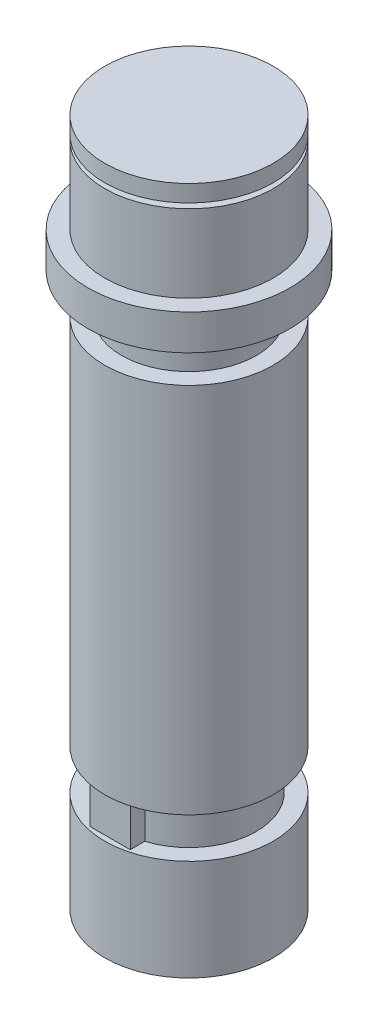
from build123d import *

# Parameters (mm, degrees)
SKETCH1_R            = 20
BOSS_EXTRUDE4_DEPTH  = 11.938
SKETCH2_R            = 25
BOSS_EXTRUDE8_DEPTH  = 30
BOSS_EXTRUDE9_START  = 110.4
SKETCH7_R            = 25
BOSS_EXTRUDE9_DEPTH  = 110.4
SKETCH8_R            = 20
BOSS_EXTRUDE11_DEPTH = 11.9
BOSS_EXTRUDE12_START = -12.9
BOSS_EXTRUDE12_DEPTH = 12.9
SKETCH12_R           = 30
BOSS_EXTRUDE14_DEPTH = 10.5
BOSS_EXTRUDE15_START = 23
SKETCH14_R           = 25
BOSS_EXTRUDE15_DEPTH = 23
SKETCH15_R           = 5
BOSS_EXTRUDE17_DEPTH = 1.5
BOSS_EXTRUDE21_START = 5
SKETCH17_R           = 25
BOSS_EXTRUDE21_DEPTH = 5


with BuildPart() as part:
    # Sketch1 → Boss-Extrude4 (new body)
    with BuildSketch(Plane(origin=(0, 0, 0), x_dir=(1, 0, 0), z_dir=(0, 1, 0))):
        Circle(SKETCH1_R)
        with BuildLine():
            Line((-5.969, -19.088505416), (-5.969, -23.406505416))
            Line((-5.969, -23.406505416), (5.969, -23.406505416))
            Line((5.969, -23.406505416), (5.969, -19.088505416))
            ThreePointArc((5.969, -19.088505416), (0, -20), (-5.969, -19.088505416))
        make_face()
    extrude(amount=BOSS_EXTRUDE4_DEPTH)

    # Sketch2 → Boss-Extrude8 (add)
    with BuildSketch(Plane(origin=(0, 0, 0), x_dir=(1, 0, 0), z_dir=(0, 1, 0))):
        with Locations(Location((0, 0, 0), (0, 0, 270))):
            Circle(SKETCH2_R)
    extrude(amount=-BOSS_EXTRUDE8_DEPTH)

    # Sketch7 → Boss-Extrude9 (add)
    with BuildSketch(Plane(origin=(0, 11.938, 0), x_dir=(1, 0, 0), z_dir=(0, 1, 0)).offset(BOSS_EXTRUDE9_START)):
        with Locations(Location((0, 0, 0), (0, 0, 270))):
            Circle(SKETCH7_R)
    extrude(amount=-BOSS_EXTRUDE9_DEPTH)

    # Sketch8 → Boss-Extrude11 (add)
    with BuildSketch(Plane(origin=(0, 122.338, 0), x_dir=(1, 0, 0), z_dir=(0, 1, 0))):
        with Locations(Location((0, 0, 0), (0, 0, 90))):
            Circle(SKETCH8_R)
    extrude(amount=BOSS_EXTRUDE11_DEPTH)

    # Sketch9 → Boss-Extrude12 (add)
    with BuildSketch(Plane(origin=(0, 134.238, 0), x_dir=(1, 0, 0), z_dir=(0, 1, 0)).offset(BOSS_EXTRUDE12_START)):
        with BuildLine():
            Line((-5.95, 19.094436362), (-5.95, 23.394436362))
            Line((-5.95, 23.394436362), (5.95, 23.394436362))
            Line((5.95, 23.394436362), (5.95, 19.094436362))
            ThreePointArc((5.95, 19.094436362), (0, 20), (-5.95, 19.094436362))
        make_face()
    extrude(amount=BOSS_EXTRUDE12_DEPTH)

    # Sketch12 → Boss-Extrude14 (add)
    with BuildSketch(Plane(origin=(0, 134.238, 0), x_dir=(1, 0, 0), z_dir=(0, 1, 0))):
        with Locations(Location((0, 0, 0), (0, 0, 90))):
            Circle(SKETCH12_R)
    extrude(amount=BOSS_EXTRUDE14_DEPTH)

    # Sketch14 → Boss-Extrude15 (add)
    with BuildSketch(Plane(origin=(0, 144.738, 0), x_dir=(1, 0, 0), z_dir=(0, 1, 0)).offset(BOSS_EXTRUDE15_START)):
        with Locations(Location((0, 0, 0), (0, 0, 270))):
            Circle(SKETCH14_R)
    extrude(amount=-BOSS_EXTRUDE15_DEPTH)

    # Sketch15 → Boss-Extrude17 (add)
    with BuildSketch(Plane(origin=(0, 167.738, 0), x_dir=(1, 0, 0), z_dir=(0, 1, 0))):
        with Locations(Location((0, 8, 0), (0, 0, 270))):
            Circle(SKETCH15_R)
        with Locations(Location((0, -8, 0), (0, 0, 270))):
            Circle(SKETCH15_R)
    extrude(amount=BOSS_EXTRUDE17_DEPTH)

    # Sketch17 → Boss-Extrude21 (add)
    with BuildSketch(Plane(origin=(0, 169.238, 0), x_dir=(1, 0, 0), z_dir=(0, 1, 0)).offset(BOSS_EXTRUDE21_START)):
        with Locations(Location((0, 0, 0), (0, 0, 270))):
            Circle(SKETCH17_R)
    extrude(amount=-BOSS_EXTRUDE21_DEPTH)


solid = part.part
